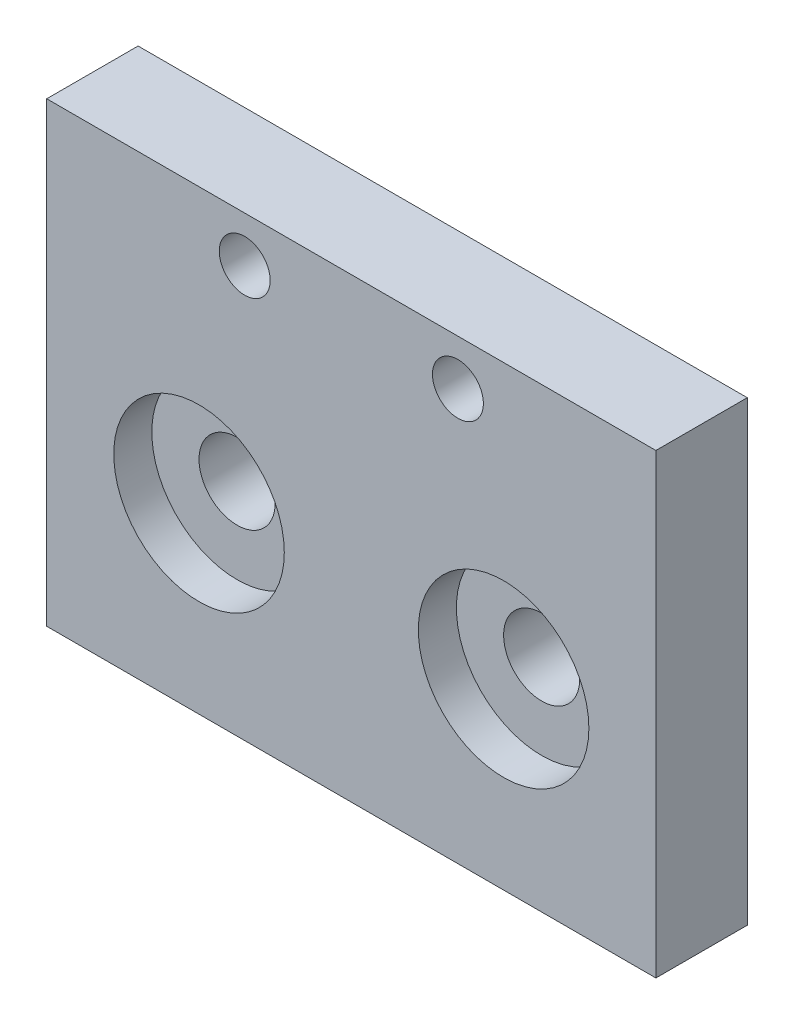
from build123d import *

# Parameters (mm, degrees)
SKETCH1_W           = 63.5
SKETCH1_H           = 47.625
SKETCH1_R           = 8.89
SKETCH1_R_2         = 2.6543
SKETCH1_R_3         = 3.96875
BOSS_EXTRUDE1_DEPTH = 9.525
CUT_EXTRUDE2_START  = 5.55752
SKETCH1_3_R         = 8.89
SKETCH1_3_R_2       = 3.96875
CUT_EXTRUDE2_DEPTH  = 3.96748


with BuildPart() as part:
    # Sketch1 → Boss-Extrude1 (new body)
    # profile 1 of 3: a face of its own
    with BuildSketch(Plane.XY):
        with Locations((0, -23.8125)):
            Rectangle(SKETCH1_W, SKETCH1_H)
        with Locations((-15.875, -28.575)):
            Circle(SKETCH1_R, mode=Mode.SUBTRACT)
        with Locations(Location((11.1125, -4.7625, 0), (0, 0, 180))):
            Circle(SKETCH1_R_2, mode=Mode.SUBTRACT)
        with Locations(Location((-11.1125, -4.7625, 0), (0, 0, 180))):
            Circle(SKETCH1_R_2, mode=Mode.SUBTRACT)
        with Locations((15.875, -28.575)):
            Circle(SKETCH1_R, mode=Mode.SUBTRACT)
    # profile 2 of 3: a face of its own
    with BuildSketch(Plane.XY):
        with Locations((-15.875, -28.575)):
            Circle(SKETCH1_R)
        with Locations(Location((-15.875, -28.575, 0), (0, 0, 180))):
            Circle(SKETCH1_R_3, mode=Mode.SUBTRACT)
    # profile 3 of 3: a face of its own
    with BuildSketch(Plane.XY):
        with Locations((15.875, -28.575)):
            Circle(SKETCH1_R)
        with Locations(Location((15.875, -28.575, 0), (0, 0, 180))):
            Circle(SKETCH1_R_3, mode=Mode.SUBTRACT)
    extrude(amount=BOSS_EXTRUDE1_DEPTH)

    # Sketch1<3> → Cut-Extrude2 (cut)
    # profile 1 of 2: a face of its own
    with BuildSketch(Plane.XY.offset(CUT_EXTRUDE2_START)):
        with Locations((-15.875, -28.575)):
            Circle(SKETCH1_3_R)
        with Locations(Location((-15.875, -28.575, 0), (0, 0, 180))):
            Circle(SKETCH1_3_R_2, mode=Mode.SUBTRACT)
    # profile 2 of 2: a face of its own
    with BuildSketch(Plane.XY.offset(CUT_EXTRUDE2_START)):
        with Locations((15.875, -28.575)):
            Circle(SKETCH1_3_R)
        with Locations(Location((15.875, -28.575, 0), (0, 0, 180))):
            Circle(SKETCH1_3_R_2, mode=Mode.SUBTRACT)
    extrude(amount=CUT_EXTRUDE2_DEPTH, mode=Mode.SUBTRACT)


solid = part.part
